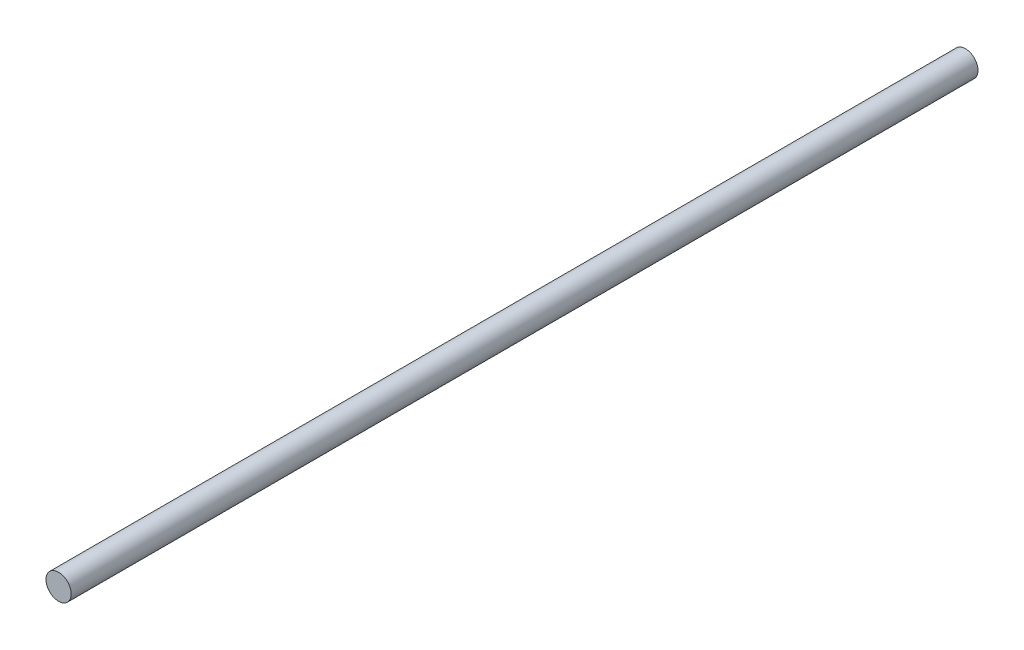
from build123d import *

# Parameters (mm, degrees)
SKETCH1_R           = 3.175
BOSS_EXTRUDE1_DEPTH = 114.3


with BuildPart() as part:
    # Sketch1 → Boss-Extrude1 (new, symmetric)
    with BuildSketch(Plane.XY):
        Circle(SKETCH1_R)
    extrude(amount=BOSS_EXTRUDE1_DEPTH, both=True)


solid = part.part
